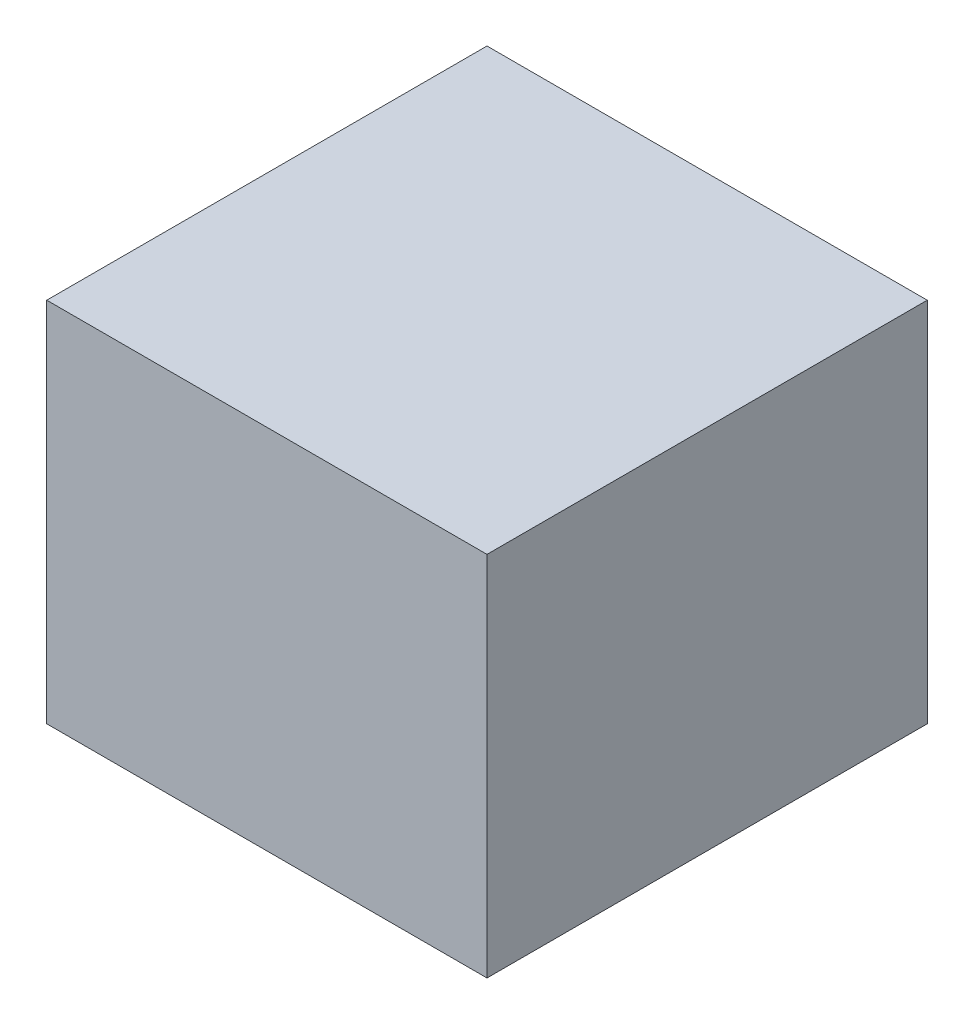
from build123d import *

# Parameters (mm, degrees)
SKETCH_1_W      = 30
SKETCH_1_H      = 30
EXTRUDE_1_DEPTH = 25


with BuildPart() as part:
    # 草图1 → 凸台-拉伸1 (new body)
    with BuildSketch(Plane(origin=(0, 0, 0), x_dir=(1, 0, 0), z_dir=(0, 1, 0))):
        with Locations((15, -15)):
            Rectangle(SKETCH_1_W, SKETCH_1_H)
    extrude(amount=EXTRUDE_1_DEPTH)


solid = part.part
